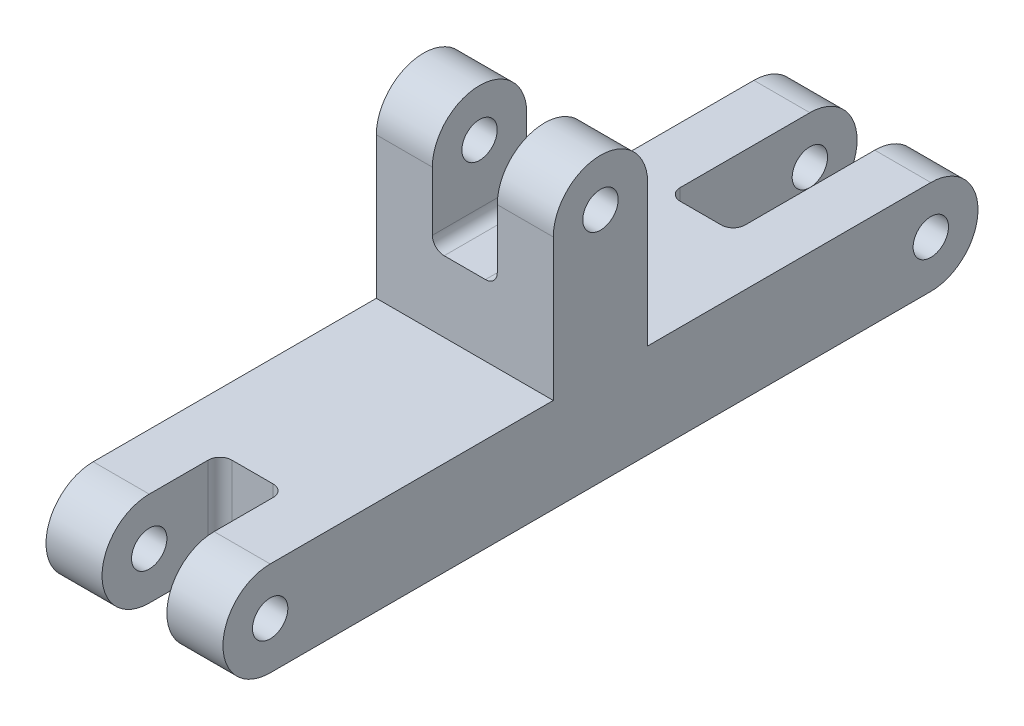
from build123d import *

# Parameters (mm, degrees)
CROQUIS1_R              = 1.5
SALIENTE_EXTRUIR1_DEPTH = 7.5
CROQUIS2_W              = 8
CROQUIS2_H              = 10
CROQUIS2_W_2            = 16
CROQUIS2_H_2            = 8
CROQUIS2_W_3            = 10
CORTAR_EXTRUIR1_DEPTH   = 2.75
REDONDEO1_R             = 1


with BuildPart() as part:
    # Croquis1 → Saliente-Extruir1 (new, symmetric)
    with BuildSketch(Plane(origin=(0, 0, 0), x_dir=(0, 0, -1), z_dir=(1, 0, 0))):
        with BuildLine():
            Line((-15, -4), (15, -4))
            ThreePointArc((15, -4), (19, 0), (15, 4))
            Line((15, 4), (-9, 4))
            Line((-9, 4), (-9, 16))
            ThreePointArc((-9, 16), (-13, 20), (-17, 16))
            Line((-17, 16), (-17, 4))
            Line((-17, 4), (-41, 4))
            ThreePointArc((-41, 4), (-45, 0), (-41, -4))
            Line((-41, -4), (-15, -4))
        make_face()
        with Locations((15, 0)):
            Circle(CROQUIS1_R, mode=Mode.SUBTRACT)
        with Locations((-13, 16)):
            Circle(CROQUIS1_R, mode=Mode.SUBTRACT)
        with Locations((-41, 0)):
            Circle(CROQUIS1_R, mode=Mode.SUBTRACT)
    extrude(amount=SALIENTE_EXTRUIR1_DEPTH, both=True)

    # Croquis2 → Cortar-Extruir1 (cut, symmetric)
    with BuildSketch(Plane(origin=(0, 0, 0), x_dir=(0, 0, -1), z_dir=(1, 0, 0))):
        with Locations((-13, 15)):
            Rectangle(CROQUIS2_W, CROQUIS2_H)
        with Locations((11, 0)):
            Rectangle(CROQUIS2_W_2, CROQUIS2_H_2)
        with Locations((-40, 0)):
            Rectangle(CROQUIS2_W_3, CROQUIS2_H_2)
    extrude(amount=CORTAR_EXTRUIR1_DEPTH, both=True, mode=Mode.SUBTRACT)

    # Redondeo1
    redondeo1_edges = [part.edges().sort_by_distance(p)[0] for p in [
        (2.75, 10, 13),
        (-2.75, 10, 13),
        (2.75, 0, 35),
        (-2.75, 0, 35),
        (2.75, 0, -3),
        (-2.75, 0, -3),
    ]]
    fillet(redondeo1_edges, radius=REDONDEO1_R)


solid = part.part
